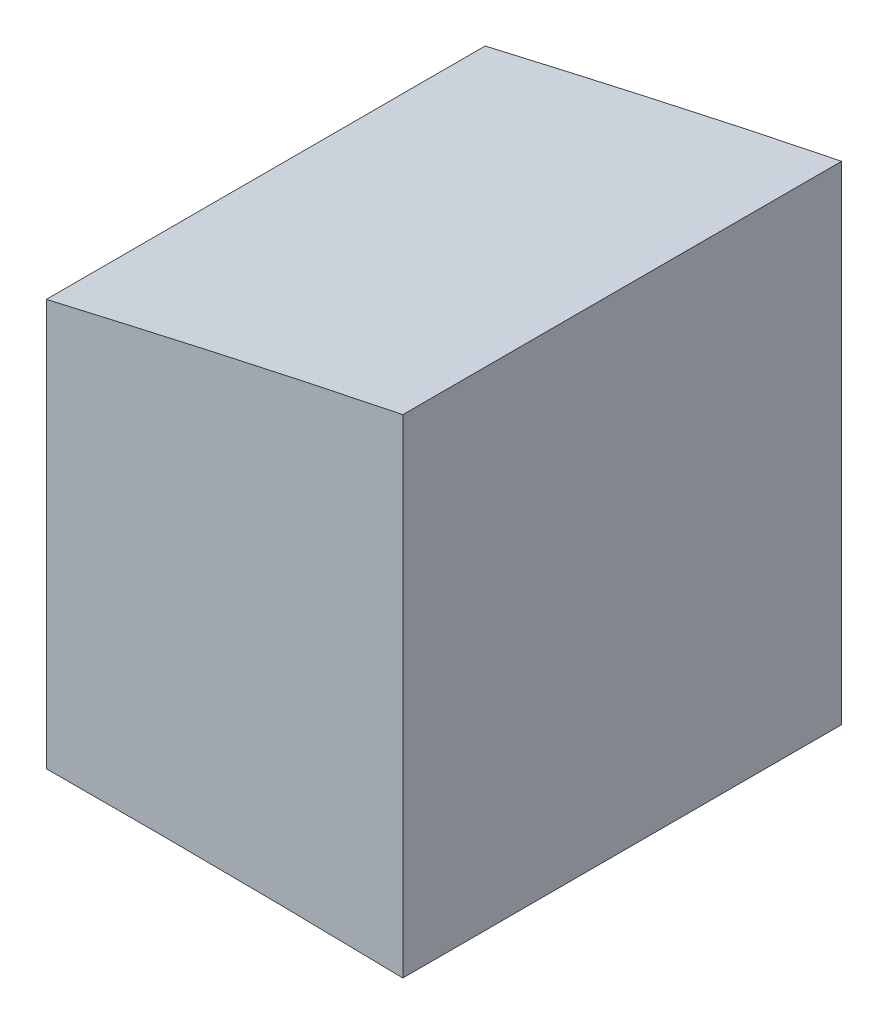
from build123d import *

# Parameters (mm, degrees)
SKETCH1_R           = 2.127
BOSS_EXTRUDE1_DEPTH = 22.225
SKETCH2_W           = 215.463137009
SKETCH2_H           = 53.36276468
CUT_EXTRUDE1_DEPTH  = 28.956


with BuildPart() as part:
    # Sketch1 → Boss-Extrude1 (new body)
    with BuildSketch(Plane.XY):
        with BuildLine():
            Line((-66.006971629, 14.952323969), (-66.006971629, -5.634708623))
            add(Edge.make_bspline(
                [(-66.006971629, -5.634708623), (-44.594037188, -5.53917688), (-13.013022308, -6.724098502), (26.136656569, -12.750856754), (48.765267423, -16.900764204), (64.683362663, -16.969052393), (75.290630493, -17.522529218), (76.216996263, -12.308293591)],
                knots=[0.133250972, 0.133250972, 0.133250972, 0.133250972, 0.517329722, 0.696666541, 0.849409938, 0.919519723, 1, 1, 1, 1], degree=3))
            add(Edge.make_bspline(
                [(76.216996263, -12.308293591), (75.606952539, -6.766559658), (69.704300689, 1.138389205), (56.422236631, 10.264383598), (36.976103105, 19.370772836), (8.741687209, 24.815403957), (-27.455234983, 23.566672909), (-52.387628688, 18.103631651), (-66.006971629, 14.952323969)],
                knots=[0, 0, 0, 0, 0.086586993, 0.161737428, 0.268322265, 0.445156627, 0.638028873, 0.872370876, 0.872370876, 0.872370876, 0.872370876], degree=3))
        make_face()
        with Locations((63.516996263, -7.228293591)):
            Circle(SKETCH1_R, mode=Mode.SUBTRACT)
        with Locations((-25.383003737, 13.091706409)):
            Circle(SKETCH1_R, mode=Mode.SUBTRACT)
    extrude(amount=BOSS_EXTRUDE1_DEPTH)

    # Sketch2 → Cut-Extrude1 (cut)
    with BuildSketch(Plane.XY.offset(22.225)):
        with Locations((59.780513575, 4.011118028)):
            Rectangle(SKETCH2_W, SKETCH2_H)
    extrude(amount=-CUT_EXTRUDE1_DEPTH, mode=Mode.SUBTRACT)


solid = part.part
